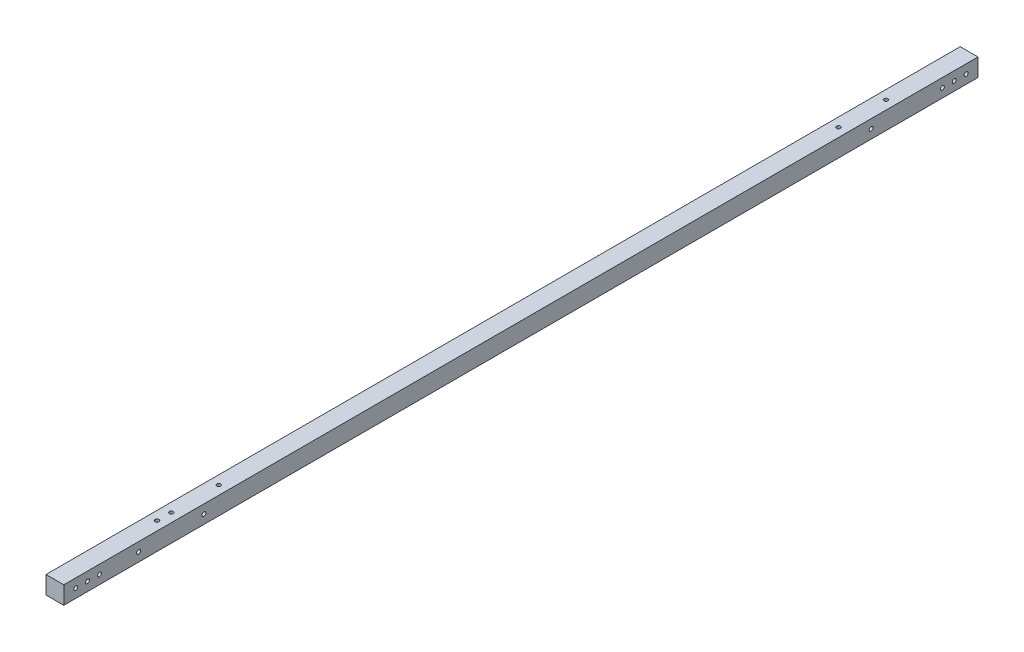
from build123d import *

# Parameters (mm, degrees)
SKETCH_1_W          = 15
SKETCH_1_H          = 15
EXTRUDE_1_DEPTH     = 657
SKETCH_2_R          = 1.65
CUT_EXTRUDE_1_DEPTH = 1000
SKETCH_4_R          = 1.65
CUT_EXTRUDE_2_DEPTH = 20
SKETCH_5_W          = 15
SKETCH_5_H          = 15
EXTRUDE_2_DEPTH     = 20
SKETCH_6_W          = 15
SKETCH_6_H          = 15
EXTRUDE_3_DEPTH     = 23
SKETCH_7_W          = 15
SKETCH_7_H          = 15
EXTRUDE_4_DEPTH     = 30
SKETCH_8_W          = 15
SKETCH_8_H          = 15
EXTRUDE_5_DEPTH     = 30
SKETCH_9_W          = 15
SKETCH_9_H          = 15
EXTRUDE_6_DEPTH     = 10
SKETCH_10_R         = 1.65
CUT_EXTRUDE_3_DEPTH = 20


with BuildPart() as part:
    # 草图1 → 凸台-拉伸1 (new body)
    with BuildSketch(Plane.XY):
        Rectangle(SKETCH_1_W, SKETCH_1_H)
    extrude(amount=EXTRUDE_1_DEPTH)

    # 草图2 → 切除-拉伸1 (cut)
    with BuildSketch(Plane.XZ.offset(7.5)):
        with Locations(Location((0, 624, 0), (0, 0, 270))):
            Circle(SKETCH_2_R)
        with Locations(Location((0, 612, 0), (0, 0, 270))):
            Circle(SKETCH_2_R)
        with Locations(Location((0, 572, 0), (0, 0, 270))):
            Circle(SKETCH_2_R)
        with Locations(Location((0, 10, 0), (0, 0, 270))):
            Circle(SKETCH_2_R)
        with Locations(Location((0, 50, 0), (0, 0, 270))):
            Circle(SKETCH_2_R)
    extrude(amount=-CUT_EXTRUDE_1_DEPTH, mode=Mode.SUBTRACT)

    # 草图4 → 切除-拉伸2 (cut)
    with BuildSketch(Plane(origin=(7.5, 0, 0), x_dir=(0, 0, -1), z_dir=(1, 0, 0))):
        with Locations((-647, 0)):
            Circle(SKETCH_4_R)
        with Locations((-592, 0)):
            Circle(SKETCH_4_R)
        with Locations((-30, 0)):
            Circle(SKETCH_4_R)
    extrude(amount=-CUT_EXTRUDE_2_DEPTH, mode=Mode.SUBTRACT)

    # 草图5 → 凸台-拉伸2 (add)
    with BuildSketch(Plane(origin=(0, 0, 0), x_dir=(-1, 0, 0), z_dir=(0, 0, -1))):
        Rectangle(SKETCH_5_W, SKETCH_5_H)
    extrude(amount=EXTRUDE_2_DEPTH)

    # 草图6 → 凸台-拉伸3 (add)
    with BuildSketch(Plane.XY.offset(657)):
        Rectangle(SKETCH_6_W, SKETCH_6_H)
    extrude(amount=EXTRUDE_3_DEPTH)

    # 草图7 → 凸台-拉伸4 (add)
    with BuildSketch(Plane.XY.offset(680)):
        Rectangle(SKETCH_7_W, SKETCH_7_H)
    extrude(amount=EXTRUDE_4_DEPTH)

    # 草图8 → 凸台-拉伸5 (add)
    with BuildSketch(Plane(origin=(0, 0, -20), x_dir=(-1, 0, 0), z_dir=(0, 0, -1))):
        Rectangle(SKETCH_8_W, SKETCH_8_H)
    extrude(amount=EXTRUDE_5_DEPTH)

    # 草图9 → 凸台-拉伸6 (add)
    with BuildSketch(Plane(origin=(0, 0, -50), x_dir=(-1, 0, 0), z_dir=(0, 0, -1))):
        Rectangle(SKETCH_9_W, SKETCH_9_H)
    extrude(amount=EXTRUDE_6_DEPTH)

    # 草图10 → 切除-拉伸3 (cut)
    with BuildSketch(Plane.ZY.offset(7.5)):
        with Locations((-50, 0)):
            Circle(SKETCH_10_R)
        with Locations((-40, 0)):
            Circle(SKETCH_10_R)
        with Locations((-30, 0)):
            Circle(SKETCH_10_R)
        with Locations((680, 0)):
            Circle(SKETCH_10_R)
        with Locations((690, 0)):
            Circle(SKETCH_10_R)
        with Locations((700, 0)):
            Circle(SKETCH_10_R)
    extrude(amount=-CUT_EXTRUDE_3_DEPTH, mode=Mode.SUBTRACT)


solid = part.part
